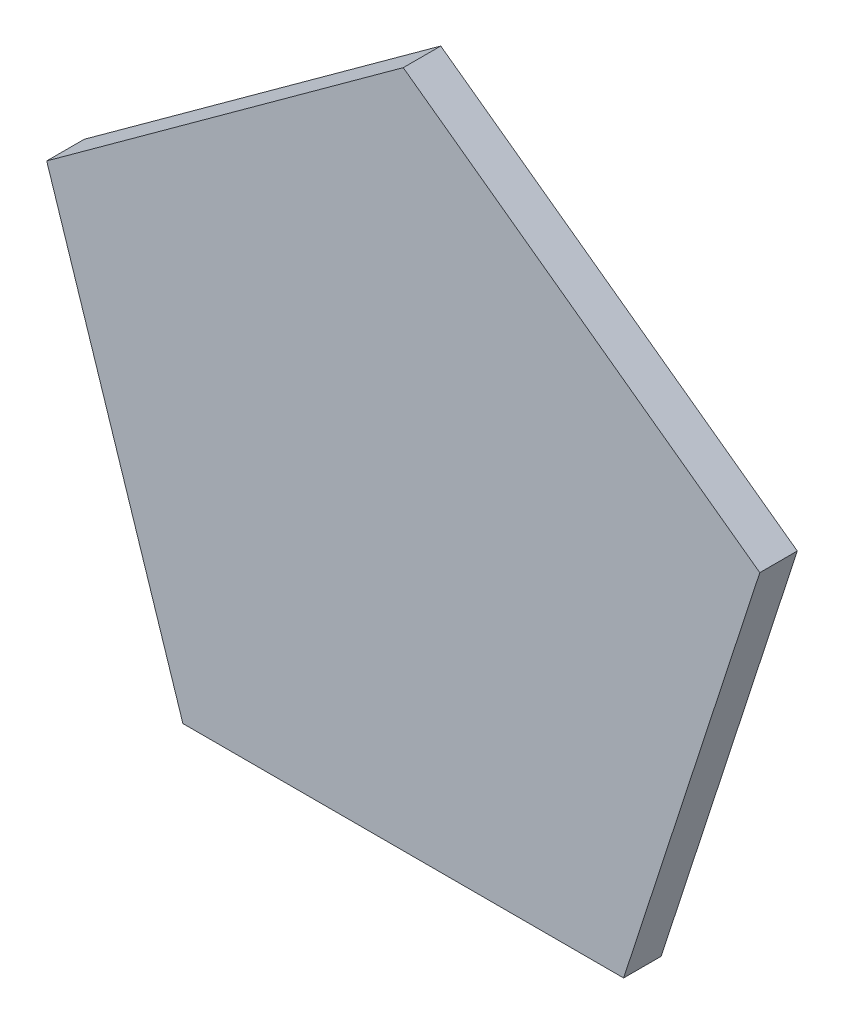
from build123d import *

# Parameters (mm, degrees)
SALIENTE_EXTRUIR1_DEPTH = 1
SALIENTE_EXTRUIR2_DEPTH = 0.5


with BuildPart() as part:
    # Croquis1 → Saliente-Extruir1 (new body)
    with BuildSketch(Plane.XY):
        Polygon((9.510565163, 3.090169944), (0, 10), (-9.510565163, 3.090169944), (-5.877852523, -8.090169944), (5.877852523, -8.090169944), align=None)
        Polygon((-8.830044516, 3.090169944), (-0.210923368, 9.352328012), (-2.250282014, 3.090169944), align=None, mode=Mode.SUBTRACT)
        Polygon((-5.664867685, -7.451242681), (-8.960012395, 2.690169944), (-3.585831742, -1.214400854), align=None, mode=Mode.SUBTRACT)
        Polygon((5.315095177, -7.690169944), (-5.318402678, -7.690169944), (-0.017323898, -3.899961523), align=None, mode=Mode.SUBTRACT)
        Polygon((8.960012395, 2.690169944), (5.66389501, -7.454236269), (3.568710751, -1.226839982), align=None, mode=Mode.SUBTRACT)
        Polygon((0.20966269, 9.353243948), (8.830044516, 3.090169944), (2.24, 3.090169944), align=None, mode=Mode.SUBTRACT)
    extrude(amount=-SALIENTE_EXTRUIR1_DEPTH)

    # Croquis1<3> → Saliente-Extruir2 (add)
    with BuildSketch(Plane.XY):
        Polygon((-2.250282014, 3.090169944), (-0.210923368, 9.352328012), (-8.830044516, 3.090169944), align=None)
        Polygon((8.830044516, 3.090169944), (0.20966269, 9.353243948), (2.24, 3.090169944), align=None)
        Polygon((-3.585831742, -1.214400854), (-8.960012395, 2.690169944), (-5.664867685, -7.451242681), align=None)
        Polygon((5.66389501, -7.454236269), (8.960012395, 2.690169944), (3.568710751, -1.226839982), align=None)
        Polygon((-0.017323898, -3.899961523), (-5.318402678, -7.690169944), (5.315095177, -7.690169944), align=None)
    extrude(amount=-SALIENTE_EXTRUIR2_DEPTH)


solid = part.part
